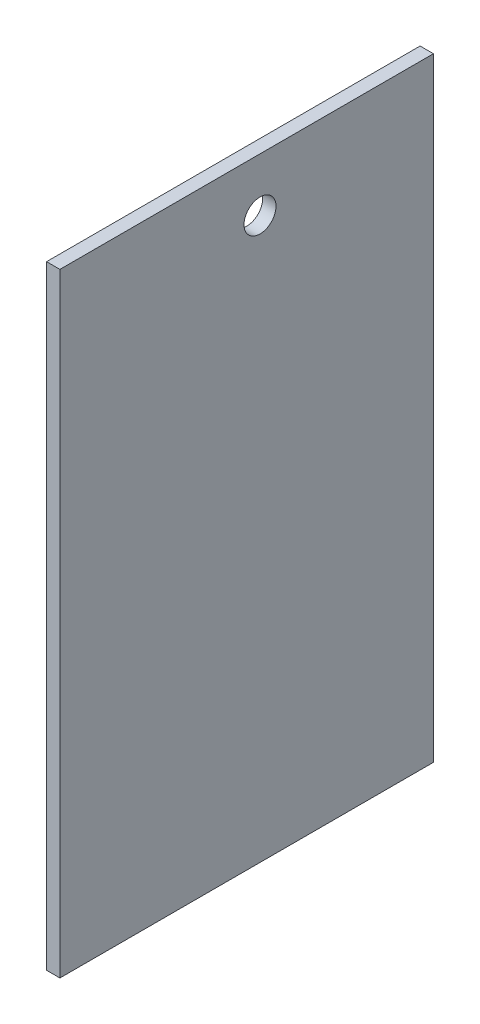
from build123d import *

# Parameters (mm, degrees)
SKETCH1_W           = 88.9
SKETCH1_H           = 146.05
BOSS_EXTRUDE1_DEPTH = 3.175
SKETCH2_R           = 3.81
CUT_EXTRUDE1_DEPTH  = 86.548429267


with BuildPart() as part:
    # Sketch1 → Boss-Extrude1 (new body)
    with BuildSketch(Plane(origin=(0, 0, 0), x_dir=(0, 0, -1), z_dir=(1, 0, 0))):
        Rectangle(SKETCH1_W, SKETCH1_H)
    extrude(amount=BOSS_EXTRUDE1_DEPTH)

    # Sketch2 → Cut-Extrude1 (cut, through all)
    with BuildSketch(Plane(origin=(3.175, 0, 0), x_dir=(0, 0, -1), z_dir=(1, 0, 0))):
        with Locations((3.175, 60.325)):
            Circle(SKETCH2_R)
    extrude(amount=-CUT_EXTRUDE1_DEPTH, mode=Mode.SUBTRACT)


solid = part.part
